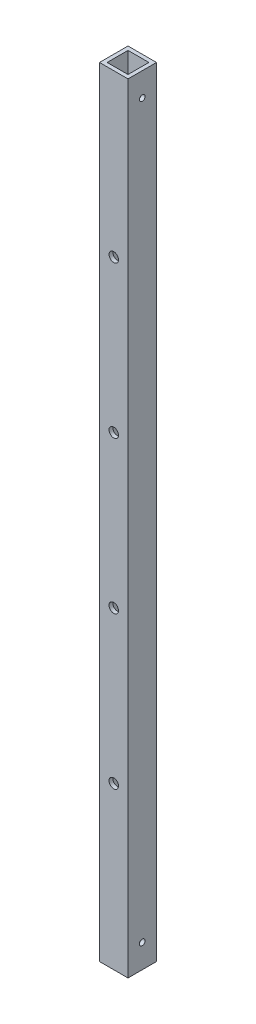
from build123d import *

# Parameters (mm, degrees)
SKETCH_1_W          = 15
SKETCH_1_H          = 15
EXTRUDE_1_DEPTH     = 410
SKETCH_2_W          = 11
SKETCH_2_H          = 11
CUT_EXTRUDE_1_DEPTH = 410
SKETCH_3_R          = 2.5
CUT_EXTRUDE_2_DEPTH = 15
SKETCH_4_R          = 1.5
CUT_EXTRUDE_3_DEPTH = 15


with BuildPart() as part:
    # 草图1 → 凸台-拉伸1 (new body)
    with BuildSketch(Plane(origin=(0, 0, 0), x_dir=(1, 0, 0), z_dir=(0, 1, 0))):
        Rectangle(SKETCH_1_W, SKETCH_1_H)
    extrude(amount=EXTRUDE_1_DEPTH)

    # 草图2 → 切除-拉伸1 (cut)
    with BuildSketch(Plane(origin=(0, 410, 0), x_dir=(1, 0, 0), z_dir=(0, 1, 0))):
        Rectangle(SKETCH_2_W, SKETCH_2_H)
    extrude(amount=-CUT_EXTRUDE_1_DEPTH, mode=Mode.SUBTRACT)

    # 草图3 → 切除-拉伸2 (cut)
    with BuildSketch(Plane.XY.offset(7.5)):
        with Locations((0, 85)):
            Circle(SKETCH_3_R)
        with Locations((0, 165)):
            Circle(SKETCH_3_R)
        with Locations((0, 245)):
            Circle(SKETCH_3_R)
        with Locations((0, 325)):
            Circle(SKETCH_3_R)
    extrude(amount=-CUT_EXTRUDE_2_DEPTH, mode=Mode.SUBTRACT)

    # 草图4 → 切除-拉伸3 (cut)
    with BuildSketch(Plane.ZY.offset(7.5)):
        with Locations((0, 12.5)):
            Circle(SKETCH_4_R)
        with Locations((0, 397.5)):
            Circle(SKETCH_4_R)
    extrude(amount=-CUT_EXTRUDE_3_DEPTH, mode=Mode.SUBTRACT)


solid = part.part
